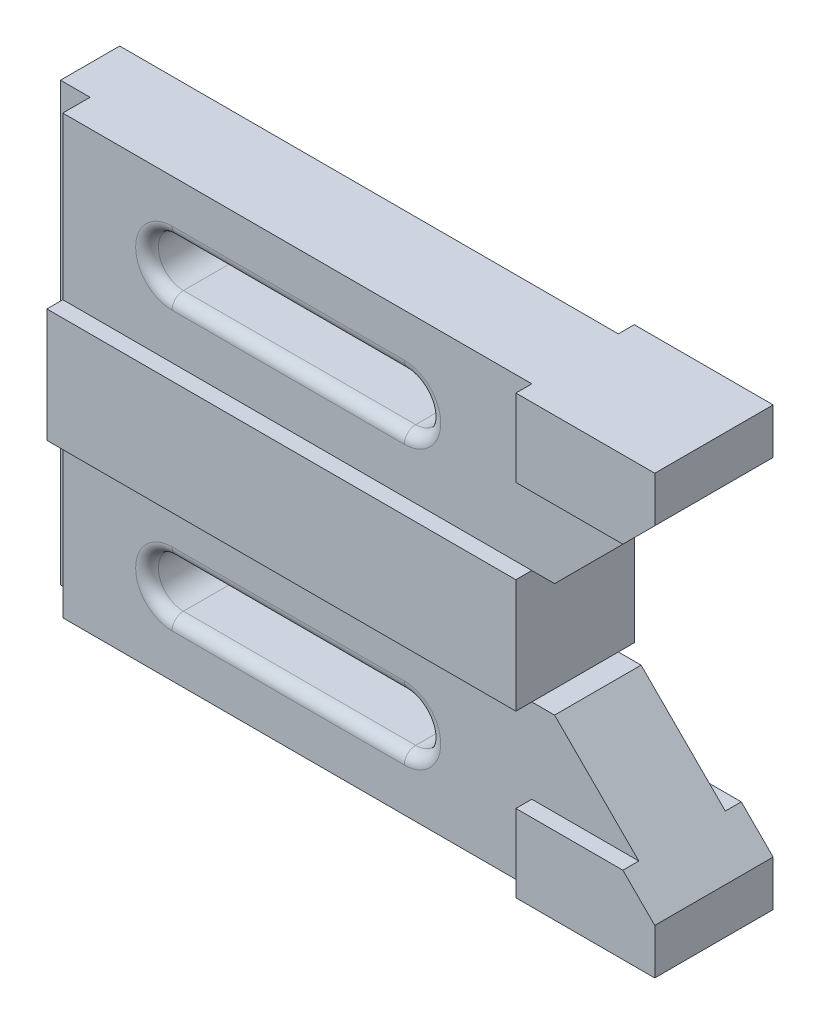
from build123d import *

# Parameters (mm, degrees)
SKETCH1_W           = 109.5
SKETCH1_H           = 25
BOSS_EXTRUDE3_DEPTH = 9.5
BOSS_EXTRUDE4_DEPTH = 3.5
BOSS_EXTRUDE5_DEPTH = 3.5
BOSS_EXTRUDE6_DEPTH = 3.5
BOSS_EXTRUDE7_DEPTH = 3.5
SKETCH13_W          = 109.5
SKETCH13_H          = 25
BOSS_EXTRUDE8_DEPTH = 3.5
SKETCH14_W          = 109.5
SKETCH14_H          = 25
BOSS_EXTRUDE9_DEPTH = 3.5
CUT_EXTRUDE1_DEPTH  = 44
FILLET1_R           = 2.5
SKETCH16_W          = 6.5
SKETCH16_H          = 96
CUT_EXTRUDE2_DEPTH  = 11.5


with BuildPart() as part:
    # Sketch1 → Boss-Extrude3 (new, symmetric)
    # profile 1 of 7: a face of its own
    with BuildSketch(Plane.XY):
        Polygon((104.5, 31), (104.5, 48), (0, 48), (0, 12.5), (109.5, 12.5), (114.5, 12.5), (133, 31), align=None)
        with BuildLine():
            ThreePointArc((30.5, 25), (25, 30.5), (30.5, 36))
            Line((30.5, 36), (81.5, 36))
            ThreePointArc((81.5, 36), (87, 30.5), (81.5, 25))
            Line((81.5, 25), (30.5, 25))
        make_face(mode=Mode.SUBTRACT)
    # profile 2 of 7: a face of its own
    with BuildSketch(Plane.XY):
        with BuildLine():
            Line((30.5, 25), (81.5, 25))
            ThreePointArc((81.5, 25), (87, 30.5), (81.5, 36))
            Line((81.5, 36), (30.5, 36))
            ThreePointArc((30.5, 36), (25, 30.5), (30.5, 25))
        make_face()
    # profile 3 of 7: a face of its own
    with BuildSketch(Plane.XY):
        Polygon((140, 38), (140, 48), (104.5, 48), (104.5, 31), (133, 31), align=None)
    # profile 4 of 7: a face of its own
    with BuildSketch(Plane.XY):
        with Locations((54.75, 0)):
            Rectangle(SKETCH1_W, SKETCH1_H)
    # profile 5 of 7: a face of its own
    with BuildSketch(Plane.XY):
        Polygon((104.5, -31), (104.5, -48), (140, -48), (140, -38), (133, -31), align=None)
    # profile 6 of 7: a face of its own
    with BuildSketch(Plane.XY):
        Polygon((109.5, -12.5), (0, -12.5), (0, -48), (104.5, -48), (104.5, -31), (133, -31), (114.5, -12.5), align=None)
        with BuildLine():
            Line((81.5, -36), (30.5, -36))
            ThreePointArc((30.5, -36), (25, -30.5), (30.5, -25))
            Line((30.5, -25), (81.5, -25))
            ThreePointArc((81.5, -25), (87, -30.5), (81.5, -36))
        make_face(mode=Mode.SUBTRACT)
    # profile 7 of 7: a face of its own
    with BuildSketch(Plane.XY):
        with BuildLine():
            ThreePointArc((81.5, -25), (87, -30.5), (81.5, -36))
            Line((81.5, -36), (30.5, -36))
            ThreePointArc((30.5, -36), (25, -30.5), (30.5, -25))
            Line((30.5, -25), (81.5, -25))
        make_face()
    extrude(amount=BOSS_EXTRUDE3_DEPTH, both=True)

    # Sketch9 → Boss-Extrude4 (add, symmetric)
    with BuildSketch(Plane.XY.offset(9.5)):
        Polygon((140, 48), (140, 38), (133, 31), (109.5, 31), (109.5, 48), align=None)
    extrude(amount=BOSS_EXTRUDE4_DEPTH, both=True)

    # Sketch10 → Boss-Extrude5 (add, symmetric)
    with BuildSketch(Plane(origin=(0, 0, -9.5), x_dir=(-1, 0, 0), z_dir=(0, 0, -1))):
        Polygon((-109.5, 48), (-140, 48), (-140, 38), (-133, 31), (-109.5, 31), align=None)
    extrude(amount=BOSS_EXTRUDE5_DEPTH, both=True)

    # Sketch11 → Boss-Extrude6 (add, symmetric)
    with BuildSketch(Plane.XY.offset(9.5)):
        Polygon((140, -38), (140, -48), (109.5, -48), (109.5, -31), (133, -31), align=None)
    extrude(amount=BOSS_EXTRUDE6_DEPTH, both=True)

    # Sketch12 → Boss-Extrude7 (add, symmetric)
    with BuildSketch(Plane(origin=(0, 0, -9.5), x_dir=(-1, 0, 0), z_dir=(0, 0, -1))):
        Polygon((-140, -48), (-140, -38), (-133, -31), (-109.5, -31), (-109.5, -48), align=None)
    extrude(amount=BOSS_EXTRUDE7_DEPTH, both=True)

    # Sketch13 → Boss-Extrude8 (add, symmetric)
    with BuildSketch(Plane.XY.offset(9.5)):
        with Locations((54.75, 0)):
            Rectangle(SKETCH13_W, SKETCH13_H)
    extrude(amount=BOSS_EXTRUDE8_DEPTH, both=True)

    # Sketch14 → Boss-Extrude9 (add, symmetric)
    with BuildSketch(Plane(origin=(0, 0, -9.5), x_dir=(-1, 0, 0), z_dir=(0, 0, -1))):
        with Locations((-54.75, 0)):
            Rectangle(SKETCH14_W, SKETCH14_H)
    extrude(amount=BOSS_EXTRUDE9_DEPTH, both=True)

    # Sketch15 → Cut-Extrude1 (cut)
    with BuildSketch(Plane.XY.offset(9.5)):
        with BuildLine():
            Line((30.5, 36), (81.5, 36))
            ThreePointArc((81.5, 36), (87, 30.5), (81.5, 25))
            Line((81.5, 25), (30.5, 25))
            ThreePointArc((30.5, 25), (25, 30.5), (30.5, 36))
        make_face()
        with BuildLine():
            Line((30.5, -25), (81.5, -25))
            ThreePointArc((81.5, -25), (87, -30.5), (81.5, -36))
            Line((81.5, -36), (30.5, -36))
            ThreePointArc((30.5, -36), (25, -30.5), (30.5, -25))
        make_face()
    extrude(amount=-CUT_EXTRUDE1_DEPTH, mode=Mode.SUBTRACT)

    # Fillet1
    fillet1_edges = [part.edges().sort_by_distance(p)[0] for p in [
        (25, 30.5, -9.5),
        (56, 36, -9.5),
        (87, 30.5, -9.5),
        (56, 25, -9.5),
        (25, 30.5, 9.5),
        (56, 25, 9.5),
        (87, 30.5, 9.5),
        (56, 36, 9.5),
        (25, -30.5, -9.5),
        (56, -25, -9.5),
        (87, -30.5, -9.5),
        (56, -36, -9.5),
        (25, -30.5, 9.5),
        (56, -36, 9.5),
        (87, -30.5, 9.5),
        (56, -25, 9.5),
    ]]
    fillet(fillet1_edges, radius=FILLET1_R)

    # Sketch16 → Cut-Extrude2 (cut)
    with BuildSketch(Plane.XY.offset(15)):
        with Locations((3.25, 0)):
            Rectangle(SKETCH16_W, SKETCH16_H)
    extrude(amount=-CUT_EXTRUDE2_DEPTH, mode=Mode.SUBTRACT)


solid = part.part
